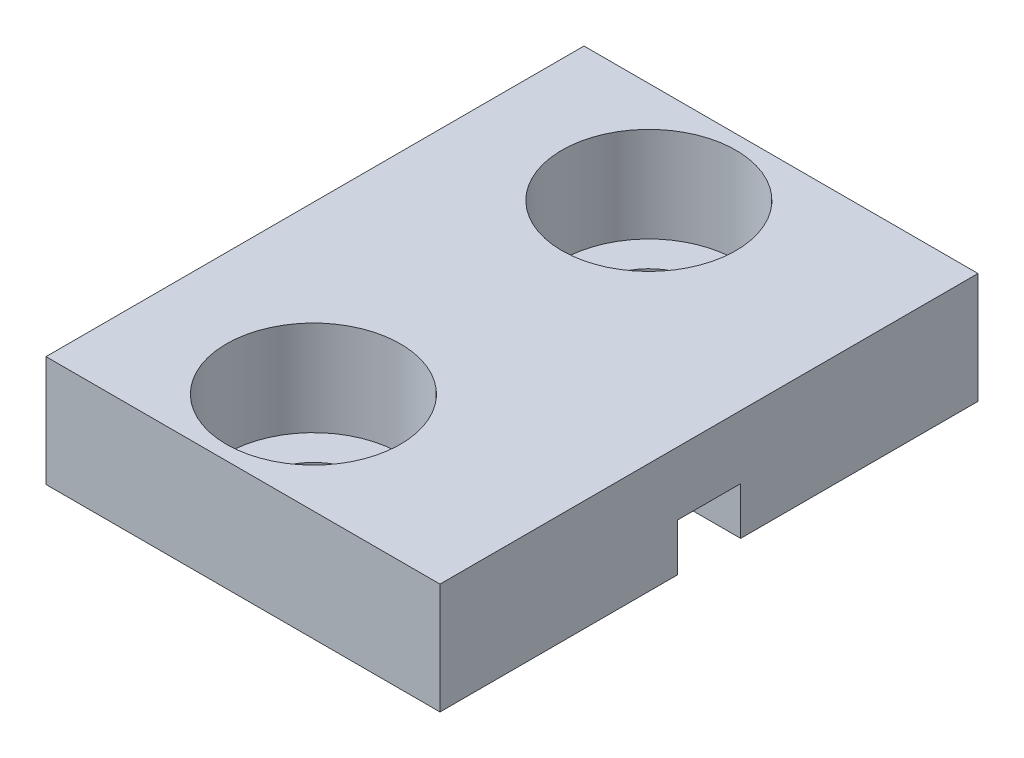
from build123d import *

# Parameters (mm, degrees)
CROQUIS1_W              = 10.5
CROQUIS1_H              = 17
CROQUIS1_R              = 1.6
SALIENTE_EXTRUIR1_DEPTH = 3.5
CROQUIS2_R              = 2.75
CORTAR_EXTRUIR1_DEPTH   = 3
CROQUIS3_W              = 2
CROQUIS3_H              = 0.5
CORTAR_EXTRUIR2_DEPTH   = 16
CROQUIS4_W              = 3
CROQUIS4_H              = 2
CORTAR_EXTRUIR3_DEPTH   = 1
SALIENTE_EXTRUIR2_DEPTH = 10
CROQUIS6_W              = 8.05
CROQUIS6_H              = 17
CORTAR_EXTRUIR4_DEPTH   = 10


with BuildPart() as part:
    # Croquis1 → Saliente-Extruir1 (new body)
    with BuildSketch(Plane(origin=(0, 0, 0), x_dir=(1, 0, 0), z_dir=(0, 1, 0))):
        with Locations((5.25, 8.5)):
            Rectangle(CROQUIS1_W, CROQUIS1_H)
        with Locations(Location((5.25, 13.8, 0), (0, 0, 270))):
            Circle(CROQUIS1_R, mode=Mode.SUBTRACT)
        with Locations(Location((5.25, 3.2, 0), (0, 0, 90))):
            Circle(CROQUIS1_R, mode=Mode.SUBTRACT)
    extrude(amount=SALIENTE_EXTRUIR1_DEPTH)

    # Croquis2 → Cortar-Extruir1 (cut)
    with BuildSketch(Plane(origin=(0, 3.5, 0), x_dir=(1, 0, 0), z_dir=(0, 1, 0))):
        with Locations(Location((5.25, 13.8, 0), (0, 0, 270))):
            Circle(CROQUIS2_R)
        with Locations(Location((5.25, 3.2, 0), (0, 0, 270))):
            Circle(CROQUIS2_R)
    extrude(amount=-CORTAR_EXTRUIR1_DEPTH, mode=Mode.SUBTRACT)

    # Croquis3 → Cortar-Extruir2 (cut)
    with BuildSketch(Plane(origin=(10.5, 0, 0), x_dir=(0, 0, -1), z_dir=(1, 0, 0))):
        with Locations((8.5, 0.25)):
            Rectangle(CROQUIS3_W, CROQUIS3_H)
    extrude(amount=-CORTAR_EXTRUIR2_DEPTH, mode=Mode.SUBTRACT)

    # Croquis4 → Cortar-Extruir3 (cut)
    with BuildSketch(Plane.XZ.offset(-0.5)):
        with Locations((9, -8.5)):
            Rectangle(CROQUIS4_W, CROQUIS4_H)
    extrude(amount=-CORTAR_EXTRUIR3_DEPTH, mode=Mode.SUBTRACT)

    # Croquis5 → Saliente-Extruir2 (add)
    with BuildSketch(Plane(origin=(10.5, 0, 0), x_dir=(0, 0, -1), z_dir=(1, 0, 0))):
        Polygon((7.5, 1.5), (9.5, 1.5), (9.5, 0), (17, 0), (17, 3.5), (0, 3.5), (0, 0), (7.5, 0), align=None)
    extrude(amount=SALIENTE_EXTRUIR2_DEPTH)

    # Croquis6 → Cortar-Extruir4 (cut)
    with BuildSketch(Plane(origin=(0, 3.5, 0), x_dir=(1, 0, 0), z_dir=(0, 1, 0))):
        with Locations((16.475, 8.5)):
            Rectangle(CROQUIS6_W, CROQUIS6_H)
    extrude(amount=-CORTAR_EXTRUIR4_DEPTH, mode=Mode.SUBTRACT)


solid = part.part
